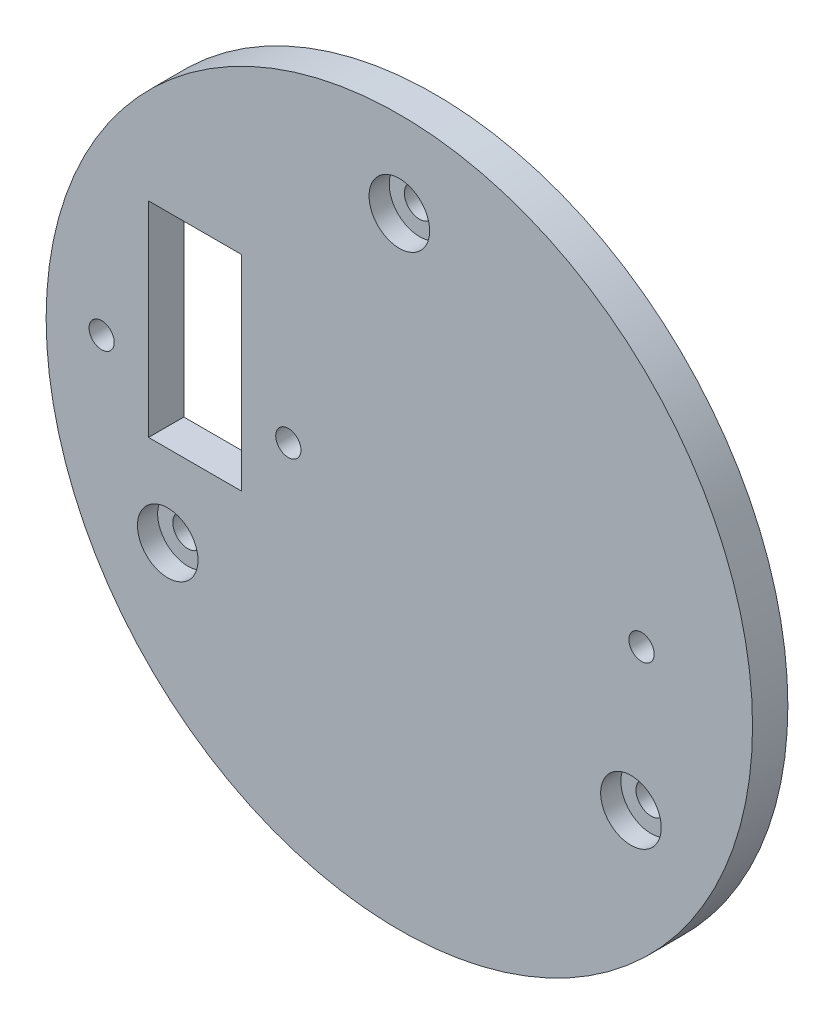
from build123d import *

# Parameters (mm, degrees)
CROQUIS2_R              = 35
SALIENTE_EXTRUIR1_DEPTH = 3.5
CROQUIS6_R              = 3
CORTAR_EXTRUIR2_DEPTH   = 2
CROQUIS7_R              = 1.5
CORTAR_EXTRUIR3_DEPTH   = 50.621064076
CROQUIS9_R              = 1.25
CORTAR_EXTRUIR5_DEPTH   = 50.621064076
CROQUIS10_W             = 9.2
CROQUIS10_H             = 20.3
CORTAR_EXTRUIR6_DEPTH   = 10


with BuildPart() as part:
    # Croquis2 → Saliente-Extruir1 (new body)
    with BuildSketch(Plane.XY):
        Circle(CROQUIS2_R)
    extrude(amount=SALIENTE_EXTRUIR1_DEPTH)

    # Croquis6 → Cortar-Extruir2 (cut)
    with BuildSketch(Plane.XY.offset(3.5)):
        with Locations((0, 26.5)):
            Circle(CROQUIS6_R)
        with Locations((22.9496732, -13.25)):
            Circle(CROQUIS6_R)
        with Locations((-22.9496732, -13.25)):
            Circle(CROQUIS6_R)
    extrude(amount=-CORTAR_EXTRUIR2_DEPTH, mode=Mode.SUBTRACT)

    # Croquis7 → Cortar-Extruir3 (cut, through all)
    with BuildSketch(Plane.XY.offset(3.5)):
        with Locations((0, 26.5)):
            Circle(CROQUIS7_R)
        with Locations((22.9496732, -13.25)):
            Circle(CROQUIS7_R)
        with Locations((-22.9496732, -13.25)):
            Circle(CROQUIS7_R)
    extrude(amount=-CORTAR_EXTRUIR3_DEPTH, mode=Mode.SUBTRACT)

    # Croquis9 → Cortar-Extruir5 (cut, through all)
    with BuildSketch(Plane(origin=(0, 0, 0), x_dir=(-1, 0, 0), z_dir=(0, 0, -1))):
        with Locations((-24, 1.3)):
            Circle(CROQUIS9_R)
        with Locations((11, 1.3)):
            Circle(CROQUIS9_R)
        with Locations((29.5, 1.3)):
            Circle(CROQUIS9_R)
    extrude(amount=-CORTAR_EXTRUIR5_DEPTH, mode=Mode.SUBTRACT)

    # Croquis10 → Cortar-Extruir6 (cut)
    with BuildSketch(Plane(origin=(0, 0, 0), x_dir=(-1, 0, 0), z_dir=(0, 0, -1))):
        with Locations((20.25, 5)):
            Rectangle(CROQUIS10_W, CROQUIS10_H)
    extrude(amount=-CORTAR_EXTRUIR6_DEPTH, mode=Mode.SUBTRACT)


solid = part.part
